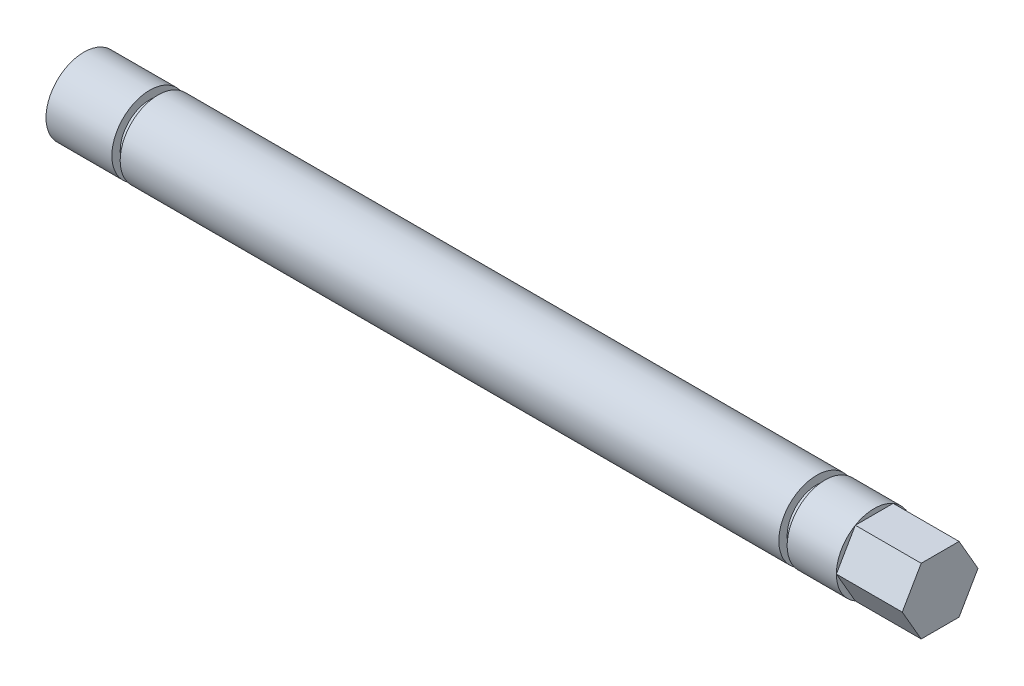
from build123d import *

# Parameters (mm, degrees)
SKETCH1_R           = 7.3025
BOSS_EXTRUDE1_DEPTH = 165.1
SKETCH2_W           = 1.6002
SKETCH2_H           = 1.6002
SKETCH3_R           = 7.3025
SKETCH3_R_2         = 5.7023
OFFSET_GROOVE_DEPTH = 1.6002
SKETCH4_OUTSIDE_W   = 49.882
SKETCH4_OUTSIDE_H   = 49.882
HEX_CUT_DEPTH       = 12.7


with BuildPart() as part:
    # Sketch1 → Boss-Extrude1 (new body)
    with BuildSketch(Plane(origin=(0, 0, 0), x_dir=(0, 0, -1), z_dir=(1, 0, 0))):
        Circle(SKETCH1_R)
    extrude(amount=BOSS_EXTRUDE1_DEPTH)

    # Sketch2 → Groove (revolve, cut)
    with BuildSketch(Plane.XY, mode=Mode.PRIVATE) as groove_sk:
        with Locations((13.5001, 6.5024)):
            Rectangle(SKETCH2_W, SKETCH2_H)
    revolve(groove_sk.sketch.rotate(Axis((0, 0, 0), (1, 0, 0)), 90), axis=Axis((0, 0, 0), (1, 0, 0)), mode=Mode.SUBTRACT)

    # Sketch3 → Offset Groove (cut)
    with BuildSketch(Plane.ZY.offset(-141.3002)):
        Circle(SKETCH3_R)
        Circle(SKETCH3_R_2, mode=Mode.SUBTRACT)
    extrude(amount=-OFFSET_GROOVE_DEPTH, mode=Mode.SUBTRACT)

    # Sketch4 outside → Hex Cut (cut)
    with BuildSketch(Plane(origin=(165.1, 0, 0), x_dir=(0, 0, -1), z_dir=(1, 0, 0))):
        Rectangle(SKETCH4_OUTSIDE_W, SKETCH4_OUTSIDE_H)
        Polygon((3.65125, 6.324150511), (-3.65125, 6.324150511), (-7.3025, 0), (-3.65125, -6.324150511), (3.65125, -6.324150511), (7.3025, 0), align=None, mode=Mode.SUBTRACT)
    extrude(amount=-HEX_CUT_DEPTH, mode=Mode.SUBTRACT)


solid = part.part
